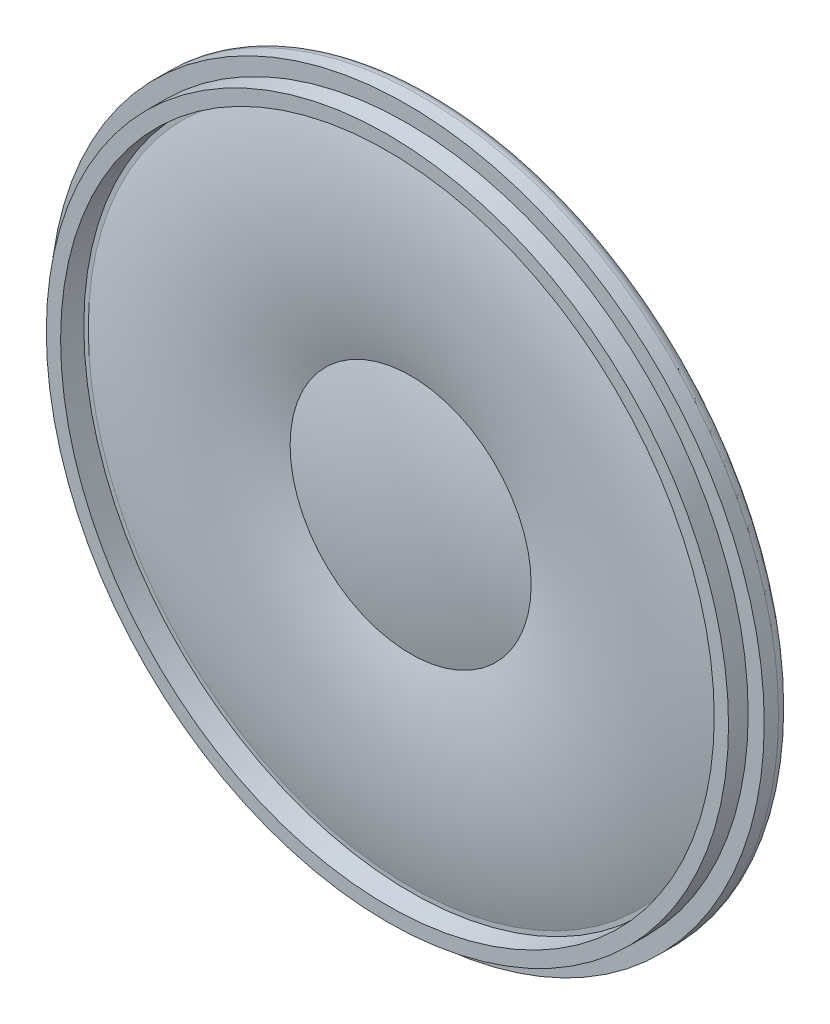
from build123d import *

# Parameters (mm, degrees)
EXTRUDE_2_DEPTH = 0.4
SKETCH_3_W      = 2.615384616
SKETCH_3_H      = 0.512820512
EXTRUDE_3_DEPTH = 0.01


with BuildPart() as part:
    # Эскиз1 → Повернуть2 (revolve)
    with BuildSketch(Plane(origin=(0, 0, 0), x_dir=(1, 0, 0), z_dir=(0, 1, 0))):
        with BuildLine():
            Line((0, 0), (7.625, 0))
            ThreePointArc((7.625, 0), (7.978553391, -0.146446609), (8.125, -0.5))
            Line((8.125, -0.5), (8.125, -1.7))
            Line((8.125, -1.7), (16.829829408, -1.7))
            ThreePointArc((16.829829408, -1.7), (17.179829408, -1.793782217), (17.43604719, -2.05))
            Line((17.43604719, -2.05), (18.1, -3.2))
            Line((18.1, -3.2), (19.3, -3.2))
            ThreePointArc((19.3, -3.2), (19.794974747, -3.405025253), (20, -3.9))
            Line((20, -3.9), (20, -4.7))
            Line((20, -4.7), (19.1, -4.7))
            Line((19.1, -4.7), (19.1, -5.8))
            Line((19.1, -5.8), (18.3, -5.8))
            Line((18.3, -5.8), (18.3, -4.5))
            Line((18.3, -4.5), (18.05, -4.5))
            ThreePointArc((18.05, -4.5), (12.4, -5.3), (6.75, -4.5))
            ThreePointArc((6.75, -4.5), (3.398621044, -5.099302558), (0, -5.3))
            Line((0, -5.3), (0, 0))
        make_face()
    revolve(axis=Axis((0, 0, 0), (0, 0, 1)))

    # Эскиз2 → Бобышка-Вытянуть2 (add)
    with BuildSketch(Plane(origin=(0, 0, 1.7), x_dir=(-1, 0, 0), z_dir=(0, 0, -1))):
        with BuildLine():
            Line((7.5, -7.81250312), (7.5, -15.066292108))
            ThreePointArc((7.5, -15.066292108), (0, -16.829829408), (-7.5, -15.066292108))
            Line((-7.5, -15.066292108), (-7.5, -7.81250312))
            ThreePointArc((-7.5, -7.81250312), (0, -10.829829408), (7.5, -7.81250312))
        make_face()
    extrude(amount=EXTRUDE_2_DEPTH)

    # Эскиз3 → Бобышка-Вытянуть3 (add)
    # profile 1 of 6: a face of its own
    with BuildSketch(Plane(origin=(0, 0, 0), x_dir=(-1, 0, 0), z_dir=(0, 0, -1))):
        with BuildLine():
            add(Edge.make_bspline(
                [(-5.763756743, 0.839227754), (-5.800249952, 0.853504104), (-5.870219534, 0.880876601), (-5.964590461, 0.935656672), (-6.044460366, 0.998673929), (-6.108848552, 1.071447993), (-6.157924056, 1.152474424), (-6.193260359, 1.240720139), (-6.213957451, 1.336676764), (-6.216681428, 1.403028298), (-6.218083667, 1.437184485)],
                knots=[0, 0, 0, 0, 1.16287356, 2.229614231, 3.228817875, 4.173350329, 5.100165549, 6.029633206, 6.985702163, 8, 8, 8, 8], degree=3))
            add(Edge.make_bspline(
                [(-6.218083667, 1.437184485), (-6.217423698, 1.463466165), (-6.21612816, 1.515057925), (-6.204934415, 1.590760098), (-6.187006019, 1.663301719), (-6.161561431, 1.732478047), (-6.129683533, 1.798858466), (-6.089459001, 1.861226858), (-6.043223399, 1.921345879), (-5.98906059, 1.976785335), (-5.92937411, 2.027562512), (-5.864724337, 2.072749212), (-5.794616571, 2.109700948), (-5.720219708, 2.140595712), (-5.641165892, 2.164783046), (-5.557176653, 2.181255968), (-5.468548072, 2.191733969), (-5.407817663, 2.193097331), (-5.376737513, 2.193795062)],
                knots=[0, 0, 0, 0, 0.994101948, 1.951453197, 2.889123786, 3.817215529, 4.736003873, 5.669743943, 6.620499649, 7.601567446, 8.596478358, 9.582687259, 10.579761808, 11.589151689, 12.62747492, 13.702346593, 14.8241243, 16, 16, 16, 16], degree=3))
            add(Edge.make_bspline(
                [(-5.376737513, 2.193795062), (-5.345459317, 2.193090247), (-5.284532921, 2.191717346), (-5.195433474, 2.181380129), (-5.110914208, 2.16405431), (-5.031024885, 2.139473334), (-4.955639556, 2.108045076), (-4.885253577, 2.069415622), (-4.819142368, 2.024222094), (-4.758995709, 1.971925543), (-4.704269418, 1.915148495), (-4.656854257, 1.854321059), (-4.616187781, 1.790862602), (-4.58258305, 1.7243876), (-4.557722142, 1.654139079), (-4.53877255, 1.581440555), (-4.527780908, 1.505428227), (-4.526452624, 1.45384595), (-4.525775974, 1.4275691)],
                knots=[0, 0, 0, 0, 1.171211919, 2.281388661, 3.353996503, 4.398126828, 5.406889753, 6.407389155, 7.400009931, 8.40008733, 9.387021643, 10.349004252, 11.283445052, 12.206096336, 13.131640667, 14.068727932, 15.016178647, 16, 16, 16, 16], degree=3))
            add(Edge.make_bspline(
                [(-4.525775974, 1.4275691), (-4.526875171, 1.394590129), (-4.529030489, 1.329924571), (-4.55099414, 1.23670863), (-4.58522637, 1.149686878), (-4.634702272, 1.070517797), (-4.697361661, 0.998383748), (-4.775116966, 0.935676828), (-4.866787332, 0.88098237), (-4.934990292, 0.853520621), (-4.970487513, 0.839227754)],
                knots=[0, 0, 0, 0, 0.998680737, 1.958225066, 2.887911823, 3.823713378, 4.77537694, 5.772726054, 6.840782926, 8, 8, 8, 8], degree=3))
            add(Edge.make_bspline(
                [(-4.970487513, 0.839227754), (-4.948091071, 0.831625223), (-4.904203761, 0.816727561), (-4.842160199, 0.787761915), (-4.783748051, 0.756530073), (-4.728637923, 0.722721585), (-4.678864066, 0.683822194), (-4.632765879, 0.642131861), (-4.590537178, 0.597063086), (-4.552754762, 0.548232554), (-4.519022761, 0.496665136), (-4.49014549, 0.442235107), (-4.465620578, 0.385717208), (-4.444660744, 0.326849354), (-4.429351242, 0.265216888), (-4.418639389, 0.201103042), (-4.41184302, 0.134845721), (-4.410880277, 0.089845194), (-4.410391359, 0.066992177)],
                knots=[0, 0, 0, 0, 1.104208047, 2.163768705, 3.193778962, 4.198696312, 5.179575955, 6.14024585, 7.100368562, 8.060719304, 9.021161243, 9.975749006, 10.935506756, 11.897452199, 12.89163552, 13.897859372, 14.932451246, 16, 16, 16, 16], degree=3))
            add(Edge.make_bspline(
                [(-4.410391359, 0.066992177), (-4.4111557, 0.03549453), (-4.41266151, -0.026558237), (-4.42589203, -0.117644416), (-4.445910392, -0.20514512), (-4.475099475, -0.288690713), (-4.512381187, -0.368340256), (-4.558499115, -0.443978087), (-4.613000135, -0.5155264), (-4.674276562, -0.583207589), (-4.742783571, -0.644388453), (-4.816895464, -0.698302293), (-4.89689032, -0.743462009), (-4.981797526, -0.780854091), (-5.072023649, -0.809832816), (-5.167452708, -0.830124067), (-5.268052947, -0.842206615), (-5.336840275, -0.843835537), (-5.37192982, -0.844666476)],
                knots=[0, 0, 0, 0, 1.017598406, 2.004746413, 2.969099523, 3.915171376, 4.859468899, 5.806714415, 6.772805022, 7.762836953, 8.753334612, 9.736396794, 10.719437652, 11.716790048, 12.730404696, 13.776887535, 14.865953843, 16, 16, 16, 16], degree=3))
            add(Edge.make_bspline(
                [(-5.37192982, -0.844666476), (-5.407015856, -0.843817629), (-5.475796303, -0.842153602), (-5.576488457, -0.830318064), (-5.67178098, -0.809106955), (-5.761889787, -0.780098774), (-5.847303687, -0.743719087), (-5.9267613, -0.697541808), (-6.001357291, -0.643696273), (-6.069911935, -0.582136988), (-6.131697354, -0.514463018), (-6.18547993, -0.441858047), (-6.23132408, -0.365439443), (-6.269052821, -0.284776416), (-6.297810725, -0.199868231), (-6.317993363, -0.111033664), (-6.33124783, -0.018340596), (-6.332717702, 0.044910028), (-6.333468282, 0.077208524)],
                knots=[0, 0, 0, 0, 1.127066097, 2.209429196, 3.250843736, 4.258219581, 5.246860502, 6.227045772, 7.204057202, 8.19754525, 9.181483529, 10.142920909, 11.095356922, 12.039670968, 12.998174893, 13.969127444, 14.962948905, 16, 16, 16, 16], degree=3))
            add(Edge.make_bspline(
                [(-6.333468282, 0.077208524), (-6.332946572, 0.101257157), (-6.331922888, 0.148444738), (-6.325669545, 0.217656077), (-6.313206754, 0.283621759), (-6.297153885, 0.346730518), (-6.276771764, 0.407140235), (-6.251626539, 0.464376512), (-6.221118902, 0.518301017), (-6.186460227, 0.569264632), (-6.147213159, 0.616909574), (-6.104013804, 0.660818607), (-6.056705241, 0.700492295), (-6.006350578, 0.737089387), (-5.950839129, 0.76802111), (-5.892235345, 0.796406729), (-5.829531673, 0.820614399), (-5.785901299, 0.832961165), (-5.763756743, 0.839227754)],
                knots=[0, 0, 0, 0, 1.117345089, 2.192424383, 3.22371675, 4.232639188, 5.215561493, 6.182180952, 7.132172269, 8.089790513, 9.041830748, 9.996006267, 10.94686322, 11.907506267, 12.882866327, 13.894317773, 14.931262935, 16, 16, 16, 16], degree=3))
        make_face()
        with BuildLine():
            add(Edge.make_bspline(
                [(-5.833468282, 1.4353816), (-5.832326748, 1.404763519), (-5.830120798, 1.345595804), (-5.806130852, 1.261552398), (-5.768617539, 1.186057851), (-5.724639763, 1.131310954), (-5.682476121, 1.094009061), (-5.647284754, 1.069103913), (-5.608827396, 1.047959944), (-5.566825441, 1.031525519), (-5.522296177, 1.016965641), (-5.473703854, 1.008827728), (-5.422190606, 1.002212088), (-5.386578295, 1.001732962), (-5.368324051, 1.00148737)],
                knots=[0, 0, 0, 0, 1.528727296, 2.954179336, 4.335216052, 5.725683216, 6.435919001, 7.148062981, 7.879427438, 8.626027458, 9.402978632, 10.2190538, 11.08711833, 12, 12, 12, 12], degree=3))
            add(Edge.make_bspline(
                [(-5.368324051, 1.00148737), (-5.350472753, 1.001742037), (-5.315663699, 1.002238624), (-5.265310651, 1.00871939), (-5.217727196, 1.017375063), (-5.173616478, 1.030491406), (-5.132469241, 1.047546476), (-5.094954727, 1.068571169), (-5.059950322, 1.092734573), (-5.019025291, 1.130321451), (-4.975108203, 1.183150896), (-4.937469174, 1.255272993), (-4.914014133, 1.334178851), (-4.911620151, 1.38914138), (-4.910391359, 1.417352754)],
                knots=[0, 0, 0, 0, 0.922112375, 1.798068639, 2.620552757, 3.419964248, 4.17189205, 4.918165909, 5.639229138, 6.36503528, 7.785020832, 9.165298717, 10.544993853, 12, 12, 12, 12], degree=3))
            add(Edge.make_bspline(
                [(-4.910391359, 1.417352754), (-4.911871881, 1.446550318), (-4.914768879, 1.50368239), (-4.938166626, 1.585698055), (-4.977558783, 1.659979753), (-5.022558862, 1.714226625), (-5.064207855, 1.753525289), (-5.099840691, 1.778541521), (-5.138146124, 1.799832548), (-5.179269943, 1.817219538), (-5.223271615, 1.831242326), (-5.270270336, 1.84044195), (-5.320068617, 1.84689397), (-5.354279008, 1.847386893), (-5.37192982, 1.847641216)],
                knots=[0, 0, 0, 0, 1.480633456, 2.897216237, 4.289382554, 5.720567045, 6.454675042, 7.191244726, 7.924224627, 8.676083236, 9.454506446, 10.26432127, 11.104478565, 12, 12, 12, 12], degree=3))
            add(Edge.make_bspline(
                [(-5.37192982, 1.847641216), (-5.389582597, 1.847395118), (-5.423995822, 1.846915363), (-5.474118823, 1.84026973), (-5.521562951, 1.831922951), (-5.565890502, 1.818527914), (-5.606917222, 1.801023715), (-5.645071636, 1.77972073), (-5.680636958, 1.755343498), (-5.722578563, 1.717797224), (-5.766505486, 1.664966582), (-5.805203869, 1.59399636), (-5.829120722, 1.516614866), (-5.832001145, 1.462794742), (-5.833468282, 1.4353816)],
                knots=[0, 0, 0, 0, 0.914830409, 1.783417199, 2.618873138, 3.411020283, 4.179090249, 4.927874451, 5.674348476, 6.410336976, 7.841713217, 9.213201474, 10.580551314, 12, 12, 12, 12], degree=3))
        make_face(mode=Mode.SUBTRACT)
        with BuildLine():
            add(Edge.make_bspline(
                [(-5.948852897, 0.084420062), (-5.948187811, 0.059741033), (-5.946855885, 0.010317965), (-5.935172032, -0.063085764), (-5.915346953, -0.135122582), (-5.889937663, -0.205860531), (-5.854096279, -0.272444506), (-5.806566573, -0.331875602), (-5.746925695, -0.381841684), (-5.67881255, -0.424054926), (-5.604483598, -0.457280379), (-5.527030655, -0.480472874), (-5.448452744, -0.495797316), (-5.395437289, -0.497607422), (-5.368925013, -0.49851263)],
                knots=[0, 0, 0, 0, 0.957879255, 1.91828174, 2.876792425, 3.856375228, 4.831004356, 5.799187063, 6.79220414, 7.836856316, 8.902268238, 9.943090861, 10.971368942, 12, 12, 12, 12], degree=3))
            add(Edge.make_bspline(
                [(-5.368925013, -0.49851263), (-5.347062782, -0.4981423), (-5.3045907, -0.497422854), (-5.242679703, -0.48920164), (-5.184345546, -0.47672737), (-5.129320975, -0.4596231), (-5.07841589, -0.436223326), (-5.030801322, -0.408874074), (-4.986964308, -0.375820409), (-4.946917257, -0.338097835), (-4.911068047, -0.296369597), (-4.880358665, -0.251353946), (-4.853570509, -0.204316837), (-4.831699204, -0.154243137), (-4.815882725, -0.101029589), (-4.803678078, -0.04563628), (-4.796315376, 0.01250814), (-4.795449276, 0.052147256), (-4.795006743, 0.072400831)],
                knots=[0, 0, 0, 0, 1.149387474, 2.232932207, 3.278773642, 4.285224938, 5.256757121, 6.220082341, 7.168479488, 8.137608443, 9.109140627, 10.056190326, 10.999892409, 11.953252726, 12.923240661, 13.915357002, 14.934853301, 16, 16, 16, 16], degree=3))
            add(Edge.make_bspline(
                [(-4.795006743, 0.072400831), (-4.79546337, 0.09305196), (-4.796357372, 0.133483582), (-4.803532964, 0.192904151), (-4.81642197, 0.249272023), (-4.832997284, 0.30343875), (-4.855461575, 0.354461987), (-4.882426811, 0.403073345), (-4.91544827, 0.447991539), (-4.951658934, 0.490741547), (-4.992637279, 0.529440186), (-5.037890199, 0.562811484), (-5.085983525, 0.592283992), (-5.138372124, 0.614891895), (-5.193901804, 0.63300134), (-5.252836378, 0.646159938), (-5.315416139, 0.654203438), (-5.358282997, 0.654949555), (-5.380343282, 0.655333524)],
                knots=[0, 0, 0, 0, 1.065858887, 2.086781919, 3.082735321, 4.047496077, 5.006086125, 5.955204095, 6.910833714, 7.878747924, 8.844339535, 9.812198509, 10.776903849, 11.749116737, 12.749729282, 13.788304076, 14.861809717, 16, 16, 16, 16], degree=3))
            add(Edge.make_bspline(
                [(-5.380343282, 0.655333524), (-5.401804505, 0.654945734), (-5.443875185, 0.654185545), (-5.504992253, 0.646096481), (-5.56285134, 0.633674362), (-5.616943399, 0.615492938), (-5.667944747, 0.5927734), (-5.714922587, 0.564205207), (-5.758715, 0.531045687), (-5.797984286, 0.492504052), (-5.833415358, 0.450637358), (-5.864049315, 0.40575639), (-5.89111131, 0.358902253), (-5.911648087, 0.308537492), (-5.92903063, 0.256290307), (-5.939897469, 0.201146637), (-5.947622434, 0.143733011), (-5.948436748, 0.104480016), (-5.948852897, 0.084420062)],
                knots=[0, 0, 0, 0, 1.135239447, 2.225422834, 3.256957183, 4.262780498, 5.240265059, 6.205773948, 7.16638056, 8.141101257, 9.111719309, 10.064571387, 11.014055337, 11.969087385, 12.938082716, 13.92369833, 14.938921288, 16, 16, 16, 16], degree=3))
        make_face(mode=Mode.SUBTRACT)
    # profile 2 of 6: a face of its own
    with BuildSketch(Plane(origin=(0, 0, 0), x_dir=(-1, 0, 0), z_dir=(0, 0, -1))):
        with BuildLine():
            add(Edge.make_bspline(
                [(-3.218083667, -0.460051092), (-3.250386324, -0.438167945), (-3.312121174, -0.396346221), (-3.396569694, -0.33093645), (-3.468841781, -0.266118825), (-3.510277416, -0.220790362), (-3.529982705, -0.199233784)],
                knots=[0, 0, 0, 0, 1.147870335, 2.193739119, 3.141007643, 4, 4, 4, 4], degree=3))
            add(Edge.make_bspline(
                [(-3.529982705, -0.199233784), (-3.556542547, -0.166303128), (-3.6099588, -0.100074109), (-3.677594602, 0.009743042), (-3.736007529, 0.127535529), (-3.785337862, 0.253322146), (-3.824501085, 0.386792759), (-3.851735376, 0.527643502), (-3.869147812, 0.675127669), (-3.870990799, 0.775876095), (-3.87192982, 0.827208524)],
                knots=[0, 0, 0, 0, 0.918345753, 1.846945796, 2.794763353, 3.771813116, 4.778497407, 5.812064506, 6.885222846, 8, 8, 8, 8], degree=3))
            add(Edge.make_bspline(
                [(-3.87192982, 0.827208524), (-3.871460331, 0.859671467), (-3.870531766, 0.923877311), (-3.863356098, 1.019225153), (-3.850341538, 1.112388946), (-3.833946275, 1.204027836), (-3.811529571, 1.293455144), (-3.784435379, 1.380930308), (-3.752459843, 1.466368098), (-3.716205559, 1.549668489), (-3.674608436, 1.629424635), (-3.62937392, 1.705408948), (-3.57844846, 1.775776496), (-3.523774077, 1.841786453), (-3.46383941, 1.902395197), (-3.400393553, 1.959121007), (-3.331968149, 2.010461129), (-3.259248024, 2.056531569), (-3.183126284, 2.097819446), (-3.104224996, 2.134325636), (-3.021987153, 2.164012812), (-2.937473011, 2.189615901), (-2.850001253, 2.208548767), (-2.760138335, 2.222653312), (-2.667333105, 2.230247656), (-2.604514193, 2.231580534), (-2.572650974, 2.2322566)],
                knots=[0, 0, 0, 0, 1.084957366, 2.145849849, 3.193091237, 4.227888347, 5.255774708, 6.272259246, 7.287044548, 8.303352674, 9.306520245, 10.291697375, 11.256019279, 12.206694375, 13.153589811, 14.102140702, 15.048846759, 16.009092651, 16.976778816, 17.941472524, 18.911610699, 19.896628563, 20.890796519, 21.900200539, 22.934932669, 24, 24, 24, 24], degree=3))
            add(Edge.make_bspline(
                [(-2.572650974, 2.2322566), (-2.545396885, 2.231959183), (-2.491620951, 2.231372338), (-2.412156781, 2.225252326), (-2.335178408, 2.214899827), (-2.260443174, 2.201346844), (-2.188301323, 2.183084795), (-2.118339886, 2.161626194), (-2.050862625, 2.13574345), (-1.98598569, 2.105512283), (-1.923152835, 2.071958702), (-1.86314327, 2.033876324), (-1.805140197, 1.992402664), (-1.749751584, 1.946585136), (-1.69697277, 1.896593542), (-1.646268289, 1.842951117), (-1.597981241, 1.785222449), (-1.568392407, 1.744067122), (-1.553420205, 1.723242177)],
                knots=[0, 0, 0, 0, 1.100388157, 2.171211883, 3.215711387, 4.235871172, 5.236440253, 6.218927258, 7.189385886, 8.152093313, 9.107568903, 10.063626423, 11.019957669, 11.985244447, 12.963760712, 13.953711893, 14.96456084, 16, 16, 16, 16], degree=3))
            add(Edge.make_bspline(
                [(-1.553420205, 1.723242177), (-1.53259277, 1.691747696), (-1.490944946, 1.628769386), (-1.439027915, 1.52758966), (-1.394348805, 1.422160953), (-1.357576046, 1.311893383), (-1.329300788, 1.196724871), (-1.30985096, 1.076934948), (-1.297409626, 0.952470307), (-1.295817943, 0.867903873), (-1.295006743, 0.824804677)],
                knots=[0, 0, 0, 0, 0.953713572, 1.907104545, 2.869101136, 3.845761926, 4.841656308, 5.862966727, 6.910863184, 8, 8, 8, 8], degree=3))
            add(Edge.make_bspline(
                [(-1.295006743, 0.824804677), (-1.296240137, 0.770255269), (-1.298642449, 0.664007956), (-1.318317435, 0.509545926), (-1.349519576, 0.364385966), (-1.395149487, 0.229496722), (-1.450781093, 0.104244863), (-1.513989949, -0.012160114), (-1.58456726, -0.120093819), (-1.638912852, -0.185100807), (-1.665800013, -0.21726263)],
                knots=[0, 0, 0, 0, 1.157132258, 2.25377685, 3.298521289, 4.302628847, 5.26939645, 6.203329808, 7.111108029, 8, 8, 8, 8], degree=3))
            add(Edge.make_bspline(
                [(-1.665800013, -0.21726263), (-1.683931908, -0.237187247), (-1.722017427, -0.279038324), (-1.788286902, -0.338914612), (-1.864567542, -0.399999722), (-1.920000117, -0.439494152), (-1.948852897, -0.460051092)],
                knots=[0, 0, 0, 0, 0.864352721, 1.815547692, 2.862987658, 4, 4, 4, 4], degree=3))
            Line((-1.948852897, -0.460051092), (-1.218083667, -0.460051092))
            Line((-1.218083667, -0.460051092), (-1.218083667, -0.806204938))
            Line((-1.218083667, -0.806204938), (-2.37192982, -0.806204938))
            Line((-2.37192982, -0.806204938), (-2.37192982, -0.460051092))
            add(Edge.make_bspline(
                [(-2.37192982, -0.460051092), (-2.348168339, -0.446840994), (-2.302689672, -0.421557317), (-2.239710565, -0.382149869), (-2.185017703, -0.343311075), (-2.153188376, -0.315658931), (-2.138155782, -0.302599169)],
                knots=[0, 0, 0, 0, 1.154624259, 2.2099115, 3.154563537, 4, 4, 4, 4], degree=3))
            add(Edge.make_bspline(
                [(-2.138155782, -0.302599169), (-2.115913689, -0.281558681), (-2.071259027, -0.23931644), (-2.011285104, -0.168364056), (-1.95647176, -0.091959178), (-1.907556696, -0.009995825), (-1.86303965, 0.075541173), (-1.824639646, 0.164568906), (-1.792151523, 0.256381149), (-1.765031099, 0.350656383), (-1.743992556, 0.447629931), (-1.729108955, 0.546792704), (-1.719780509, 0.647942779), (-1.718651943, 0.716010624), (-1.718083667, 0.750285447)],
                knots=[0, 0, 0, 0, 0.944807837, 1.896857232, 2.863286351, 3.845619181, 4.841587445, 5.838995316, 6.836786733, 7.847039831, 8.866192015, 9.898474877, 10.941799892, 12, 12, 12, 12], degree=3))
            add(Edge.make_bspline(
                [(-1.718083667, 0.750285447), (-1.719263809, 0.796812979), (-1.721632815, 0.890211907), (-1.740254986, 1.030429114), (-1.771497536, 1.170656528), (-1.805669634, 1.28700336), (-1.839664397, 1.377711303), (-1.868308504, 1.442083032), (-1.900550226, 1.501937676), (-1.935140958, 1.558137704), (-1.973825505, 1.609762204), (-2.015093508, 1.657511285), (-2.060160343, 1.700255636), (-2.107332842, 1.73963781), (-2.158179411, 1.773666869), (-2.211134606, 1.80419881), (-2.267305034, 1.829144398), (-2.325642558, 1.850417919), (-2.386778302, 1.86668488), (-2.450506251, 1.877990405), (-2.516821588, 1.884614605), (-2.561818847, 1.885601547), (-2.584670205, 1.886102754)],
                knots=[0, 0, 0, 0, 1.738390589, 3.489628818, 5.275188123, 7.103639337, 8.015747648, 8.893667832, 9.734315196, 10.554821743, 11.357338521, 12.142559931, 12.91027886, 13.676134081, 14.436075841, 15.193765041, 15.957678649, 16.729656145, 17.512303989, 18.318478645, 19.146058068, 20, 20, 20, 20], degree=3))
            add(Edge.make_bspline(
                [(-2.584670205, 1.886102754), (-2.614956512, 1.885496655), (-2.673955146, 1.884315955), (-2.759930763, 1.872625161), (-2.840478335, 1.853566597), (-2.915990174, 1.827052218), (-2.985983599, 1.792434555), (-3.051330794, 1.751109726), (-3.111046988, 1.701266334), (-3.145808392, 1.662784463), (-3.163396167, 1.643314293)],
                knots=[0, 0, 0, 0, 1.119630171, 2.181073105, 3.201784989, 4.176614547, 5.134201691, 6.083729649, 7.030449673, 8, 8, 8, 8], degree=3))
            add(Edge.make_bspline(
                [(-3.163396167, 1.643314293), (-3.186198952, 1.614074195), (-3.231853772, 1.555530847), (-3.290335773, 1.459989554), (-3.338965798, 1.357640859), (-3.37930775, 1.249287469), (-3.410668089, 1.134438953), (-3.432409862, 1.013156426), (-3.446926233, 0.88545301), (-3.448201068, 0.798003576), (-3.448852897, 0.753290254)],
                knots=[0, 0, 0, 0, 0.932229705, 1.866472867, 2.810839922, 3.778671193, 4.771305902, 5.801178366, 6.87573179, 8, 8, 8, 8], degree=3))
            add(Edge.make_bspline(
                [(-3.448852897, 0.753290254), (-3.448176739, 0.717422129), (-3.446845501, 0.646803981), (-3.439283591, 0.542604406), (-3.425228387, 0.442560434), (-3.406828954, 0.346101954), (-3.382237129, 0.253746028), (-3.351877695, 0.165189563), (-3.317438339, 0.08006289), (-3.27638725, -0.000280152), (-3.230688144, -0.076123394), (-3.180810297, -0.146947545), (-3.127312045, -0.213125448), (-3.068779188, -0.272987806), (-3.006767318, -0.328180538), (-2.940160066, -0.37740662), (-2.869968233, -0.422423618), (-2.820087411, -0.447461665), (-2.795006743, -0.460051092)],
                knots=[0, 0, 0, 0, 1.181479772, 2.326129779, 3.438375264, 4.507189826, 5.558655516, 6.583111951, 7.589044062, 8.580482758, 9.551334481, 10.503190452, 11.431640246, 12.350830639, 13.257648103, 14.162880011, 15.076274334, 16, 16, 16, 16], degree=3))
            Line((-2.795006743, -0.460051092), (-2.795006743, -0.806204938))
            Line((-2.795006743, -0.806204938), (-3.948852897, -0.806204938))
            Line((-3.948852897, -0.806204938), (-3.948852897, -0.460051092))
            Line((-3.948852897, -0.460051092), (-3.218083667, -0.460051092))
        make_face()
    # profile 3 of 6: a face of its own
    with BuildSketch(Plane(origin=(0, 0, 0), x_dir=(-1, 0, 0), z_dir=(0, 0, -1))):
        with BuildLine():
            Line((2.204993257, -0.421589553), (2.204993257, -0.806204938))
            Line((2.204993257, -0.806204938), (0.243454795, -0.806204938))
            add(Edge.make_bspline(
                [(0.243454795, -0.806204938), (0.243414637, -0.783346164), (0.243334456, -0.737705235), (0.251057637, -0.670205195), (0.263153684, -0.6036006), (0.27683068, -0.560889722), (0.283719218, -0.539378015)],
                knots=[0, 0, 0, 0, 1.01057331, 2.01775941, 3.001627217, 4, 4, 4, 4], degree=3))
            add(Edge.make_bspline(
                [(0.283719218, -0.539378015), (0.296446945, -0.504230453), (0.322362694, -0.432664227), (0.374868273, -0.329404158), (0.436627242, -0.226768585), (0.496758292, -0.143208739), (0.551825349, -0.076450263), (0.598006253, -0.024219481), (0.649183162, 0.029244878), (0.705315089, 0.08393305), (0.765861798, 0.140199227), (0.830905906, 0.198231056), (0.901215482, 0.256947048), (0.950298923, 0.295866451), (0.975425949, 0.315790254)],
                knots=[0, 0, 0, 0, 1.204657718, 2.452881516, 3.728232997, 5.065887527, 5.768225529, 6.518857853, 7.313994055, 8.154655305, 9.046094665, 9.979688118, 10.965752482, 12, 12, 12, 12], degree=3))
            add(Edge.make_bspline(
                [(0.975425949, 0.315790254), (1.014027266, 0.348280357), (1.088356552, 0.41084211), (1.193321151, 0.503677953), (1.289189227, 0.589881292), (1.374434189, 0.670963016), (1.449753252, 0.746136685), (1.515323266, 0.815231984), (1.571708415, 0.878033279), (1.618220349, 0.936813713), (1.657463894, 0.992318791), (1.690719333, 1.046460568), (1.718433329, 1.100184781), (1.741515379, 1.153321432), (1.75977132, 1.206097757), (1.77221534, 1.258667518), (1.780654444, 1.310509094), (1.781498784, 1.345005054), (1.781916333, 1.362064293)],
                knots=[0, 0, 0, 0, 1.782554561, 3.432421876, 4.950675607, 6.337395053, 7.588547463, 8.709982106, 9.702713005, 10.569305638, 11.356701089, 12.103210377, 12.812277205, 13.490692607, 14.148717897, 14.782152033, 15.397739362, 16, 16, 16, 16], degree=3))
            add(Edge.make_bspline(
                [(1.781916333, 1.362064293), (1.781498733, 1.378924488), (1.780679425, 1.412003275), (1.772905864, 1.460413872), (1.762084445, 1.507034434), (1.744589504, 1.551025688), (1.723765257, 1.593690386), (1.697053133, 1.633680379), (1.666152698, 1.671992319), (1.630774315, 1.7076161), (1.592132836, 1.741036895), (1.548956489, 1.768817693), (1.504081086, 1.79382869), (1.455958463, 1.813938966), (1.404666816, 1.8287063), (1.350579525, 1.839423582), (1.293705172, 1.846218913), (1.254892425, 1.847159927), (1.235041333, 1.847641216)],
                knots=[0, 0, 0, 0, 0.988194508, 1.938783882, 2.870742509, 3.789494954, 4.709148727, 5.651055405, 6.603531303, 7.592354411, 8.592907906, 9.593461401, 10.59787167, 11.603930315, 12.645063138, 13.723588815, 14.835711238, 16, 16, 16, 16], degree=3))
            add(Edge.make_bspline(
                [(1.235041333, 1.847641216), (1.214188314, 1.84716231), (1.173377423, 1.846225057), (1.113722828, 1.839402625), (1.057091132, 1.828978871), (1.003617503, 1.813041844), (0.953367028, 1.792965103), (0.906544364, 1.767693833), (0.862399686, 1.73916714), (0.82232328, 1.705393688), (0.786082712, 1.667945819), (0.753909524, 1.627176416), (0.727548431, 1.582298717), (0.705778354, 1.53429948), (0.688273389, 1.483027814), (0.67556538, 1.428091758), (0.668636888, 1.369649932), (0.667243626, 1.329628986), (0.666531718, 1.309179677)],
                knots=[0, 0, 0, 0, 1.131143733, 2.213731411, 3.253917892, 4.251203413, 5.236093891, 6.184197493, 7.13373276, 8.082770301, 9.020476205, 9.957489029, 10.893177274, 11.836722509, 12.812818608, 13.827831385, 14.890097571, 16, 16, 16, 16], degree=3))
            Line((0.666531718, 1.309179677), (0.281916333, 1.347641216))
            add(Edge.make_bspline(
                [(0.281916333, 1.347641216), (0.285851495, 1.381161386), (0.293507014, 1.446371993), (0.312575866, 1.540818573), (0.339346809, 1.628680965), (0.371380501, 1.711184155), (0.411537753, 1.786923692), (0.45693207, 1.857466162), (0.510472572, 1.920574253), (0.569620622, 1.978237224), (0.635024251, 2.029053474), (0.706069094, 2.073448523), (0.782722652, 2.110582241), (0.864557992, 2.141327411), (0.951762988, 2.164654545), (1.044214274, 2.181382302), (1.142060527, 2.191693482), (1.209174463, 2.19308454), (1.243454795, 2.193795062)],
                knots=[0, 0, 0, 0, 1.130804643, 2.199883102, 3.223565206, 4.205909148, 5.160801384, 6.091796021, 7.01151579, 7.927798993, 8.855738875, 9.7815393, 10.730299821, 11.705391175, 12.706931101, 13.751121791, 14.851322166, 16, 16, 16, 16], degree=3))
            add(Edge.make_bspline(
                [(1.243454795, 2.193795062), (1.278145443, 2.193201024), (1.34572303, 2.192043834), (1.444194437, 2.180203462), (1.53710493, 2.16176219), (1.624795118, 2.136060702), (1.706746915, 2.102358388), (1.783023359, 2.061181771), (1.853976147, 2.012932515), (1.918419803, 1.957031422), (1.976530332, 1.896006014), (2.027455642, 1.830878748), (2.070031653, 1.761927849), (2.106282482, 1.690093166), (2.133171061, 1.613856879), (2.152079604, 1.534255434), (2.164928508, 1.45122081), (2.16599021, 1.394566096), (2.166531718, 1.365670062)],
                knots=[0, 0, 0, 0, 1.195390245, 2.328627238, 3.413424916, 4.457841177, 5.473507151, 6.462241215, 7.441013641, 8.425227782, 9.397253344, 10.342087291, 11.269524934, 12.186751184, 13.110685745, 14.048630397, 15.004728144, 16, 16, 16, 16], degree=3))
            add(Edge.make_bspline(
                [(2.166531718, 1.365670062), (2.165704844, 1.335982661), (2.164049272, 1.276542345), (2.151127308, 1.187696601), (2.129017683, 1.099815032), (2.099706222, 1.011828065), (2.059660665, 0.923386484), (2.009069904, 0.833270236), (1.946306537, 0.741146438), (1.885945775, 0.662830975), (1.829759702, 0.597182868), (1.779956058, 0.54315064), (1.722336125, 0.485745011), (1.659061441, 0.422977891), (1.587551361, 0.357077018), (1.509860536, 0.286068949), (1.424288277, 0.211822349), (1.364884452, 0.161100636), (1.334199987, 0.134900831)],
                knots=[0, 0, 0, 0, 0.927118007, 1.856282007, 2.79721255, 3.754929441, 4.749232485, 5.824981375, 6.979078785, 8.228161913, 8.911614355, 9.677694854, 10.522803217, 11.452009355, 12.461436787, 13.560019032, 14.739651695, 16, 16, 16, 16], degree=3))
            add(Edge.make_bspline(
                [(1.334199987, 0.134900831), (1.307923378, 0.11350887), (1.257817928, 0.072717693), (1.18653322, 0.013581631), (1.122683802, -0.040644536), (1.064776568, -0.088192053), (1.01492046, -0.131360734), (0.971359368, -0.168259978), (0.935675888, -0.200745066), (0.881336267, -0.250090571), (0.8125105, -0.320427601), (0.761796732, -0.388772128), (0.73744518, -0.421589553)],
                knots=[0, 0, 0, 0, 1.241996727, 2.368296581, 3.394949853, 4.3125351, 5.114548721, 5.812230366, 6.404953749, 6.883082049, 8.503329734, 10, 10, 10, 10], degree=3))
            Line((0.73744518, -0.421589553), (2.204993257, -0.421589553))
        make_face()
    # profile 4 of 6: a face of its own
    with BuildSketch(Plane(origin=(0, 0, 0), x_dir=(-1, 0, 0), z_dir=(0, 0, -1))):
        with BuildLine():
            Line((3.22963268, -0.806204938), (2.474224026, 2.193795062))
            Line((2.474224026, 2.193795062), (2.911123064, 2.193795062))
            Line((2.911123064, 2.193795062), (3.356435564, 0.220838331))
            add(Edge.make_bspline(
                [(3.356435564, 0.220838331), (3.379514428, 0.119084983), (3.425436538, -0.083382894), (3.470859728, -0.285963286), (3.493454795, -0.386733784)],
                knots=[0, 0, 0, 0, 1.00513078, 2, 2, 2, 2], degree=3))
            add(Edge.make_bspline(
                [(3.493454795, -0.386733784), (3.50415285, -0.350499207), (3.524348829, -0.282094928), (3.551649878, -0.185125271), (3.576446547, -0.100492851), (3.597572035, -0.027803124), (3.614677262, 0.033046035), (3.629445721, 0.081306915), (3.639511717, 0.11792462), (3.645476845, 0.138112082), (3.64790191, 0.1463191)],
                knots=[0, 0, 0, 0, 1.633809233, 3.084334118, 4.356383392, 5.447555203, 6.357852567, 7.089694452, 7.629924063, 8, 8, 8, 8], degree=3))
            Line((3.64790191, 0.1463191), (4.240449987, 2.193795062))
            Line((4.240449987, 2.193795062), (4.74946441, 2.193795062))
            Line((4.74946441, 2.193795062), (5.177949987, 0.690790254))
            add(Edge.make_bspline(
                [(5.177949987, 0.690790254), (5.201596425, 0.597940512), (5.248222081, 0.414860915), (5.310171791, 0.142157073), (5.367349394, -0.123930918), (5.400284767, -0.299919153), (5.416531718, -0.386733784)],
                knots=[0, 0, 0, 0, 1.04154457, 2.053700482, 3.039894486, 4, 4, 4, 4], degree=3))
            add(Edge.make_bspline(
                [(5.416531718, -0.386733784), (5.426492366, -0.342250098), (5.447453561, -0.248638593), (5.481681962, -0.101222583), (5.517106916, 0.06086885), (5.542654855, 0.173580376), (5.555954795, 0.2322566)],
                knots=[0, 0, 0, 0, 0.862130727, 1.814268567, 2.86213528, 4, 4, 4, 4], degree=3))
            Line((5.555954795, 0.2322566), (5.998863449, 2.193795062))
            Line((5.998863449, 2.193795062), (6.435762487, 2.193795062))
            Line((6.435762487, 2.193795062), (5.679752872, -0.806204938))
            Line((5.679752872, -0.806204938), (5.214608641, -0.806204938))
            Line((5.214608641, -0.806204938), (4.587805757, 1.486463331))
            add(Edge.make_bspline(
                [(4.587805757, 1.486463331), (4.581511753, 1.508876294), (4.569555489, 1.551452578), (4.553883628, 1.612210379), (4.538342316, 1.665644364), (4.525980735, 1.712445082), (4.515282821, 1.752140926), (4.505809361, 1.784615672), (4.499716286, 1.810504905), (4.495310058, 1.825219575), (4.493454795, 1.831415254)],
                knots=[0, 0, 0, 0, 1.562239628, 2.967673567, 4.210417925, 5.296319877, 6.215971374, 6.969386481, 7.566055473, 8, 8, 8, 8], degree=3))
            add(Edge.make_bspline(
                [(4.493454795, 1.831415254), (4.482330737, 1.792125248), (4.461311733, 1.717886444), (4.430183561, 1.613373747), (4.404063753, 1.521475409), (4.387511033, 1.464620933), (4.379873064, 1.438386408)],
                knots=[0, 0, 0, 0, 1.197730334, 2.263121701, 3.198547257, 4, 4, 4, 4], degree=3))
            Line((4.379873064, 1.438386408), (3.730233641, -0.806204938))
            Line((3.730233641, -0.806204938), (3.22963268, -0.806204938))
        make_face()
    # profile 5 of 6: a face of its own
    with BuildSketch(Plane(origin=(0, 0, 0), x_dir=(-1, 0, 0), z_dir=(0, 0, -1))):
        with Locations((-3.009476426, -3.670384727)):
            Rectangle(SKETCH_3_W, SKETCH_3_H)
    # profile 6 of 6: a face of its own
    with BuildSketch(Plane(origin=(0, 0, 0), x_dir=(-1, 0, 0), z_dir=(0, 0, -1))):
        Polygon((3.067446651, -5.00371806), (3.067446651, -3.926794983), (1.990523574, -3.926794983), (1.990523574, -3.465256522), (3.067446651, -3.465256522), (3.067446651, -2.388333445), (3.528985113, -2.388333445), (3.528985113, -3.465256522), (4.605908189, -3.465256522), (4.605908189, -3.926794983), (3.528985113, -3.926794983), (3.528985113, -5.00371806), align=None)
    extrude(amount=EXTRUDE_3_DEPTH)


solid = part.part
